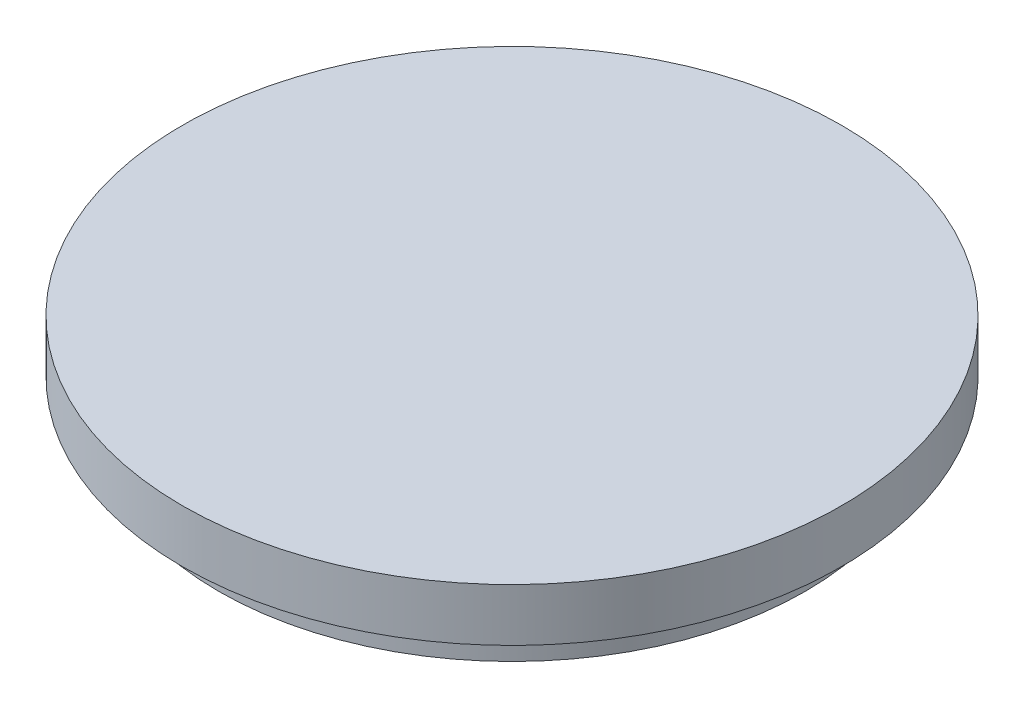
from build123d import *


with BuildPart() as part:
    # Sketch1 → Revolve1 (revolve)
    with BuildSketch(Plane.XY, mode=Mode.PRIVATE) as revolve1_sk:
        Polygon((-12.5, 4.493842365), (-12.5, 2.493842365), (-11.125, 2.493842365), (-11.125, 0.993842365), (0, 0.993842365), (0, 4.493842365), align=None)
    revolve(revolve1_sk.sketch.rotate(Axis((0, 16.90270936, 0), (0, -1, 0)), 270), axis=Axis((0, 16.90270936, 0), (0, -1, 0)))


solid = part.part
